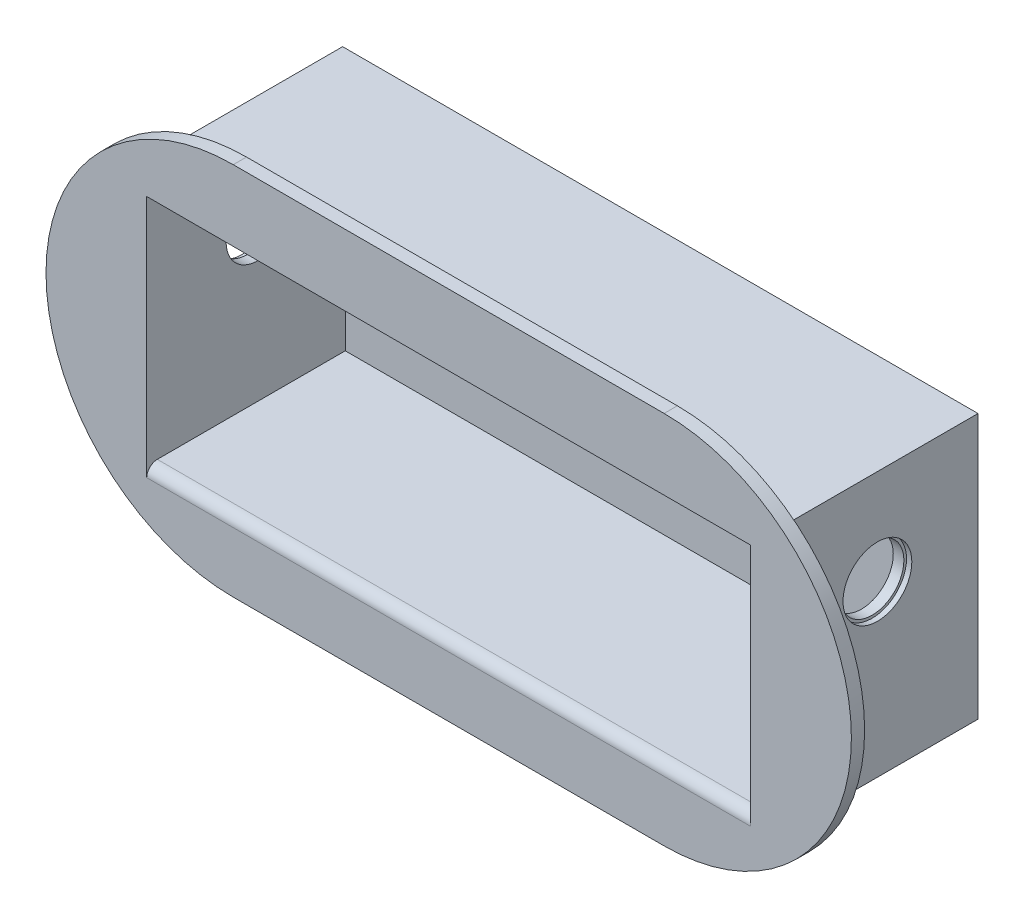
from build123d import *

# Parameters (mm, degrees)
SKETCH1_W           = 304.8
SKETCH1_H           = 127
BOSS_EXTRUDE1_DEPTH = 101.6
CUT_EXTRUDE2_DEPTH  = 95.25
SKETCH3_W           = 289.56
SKETCH3_H           = 111.76
BOSS_EXTRUDE2_DEPTH = 6.35
SKETCH5_R           = 15.24
CUT_EXTRUDE4_DEPTH  = 372.316040041
FILLET2_R           = 5.08
SKETCH6_R           = 16.51
CUT_EXTRUDE5_DEPTH  = 2.54


with BuildPart() as part:
    # Sketch1 → Boss-Extrude1 (new body)
    with BuildSketch(Plane.XY):
        Rectangle(SKETCH1_W, SKETCH1_H)
    extrude(amount=BOSS_EXTRUDE1_DEPTH)

    # 3DSketch1 → Cut-Extrude2 (cut)
    with BuildSketch(Plane(origin=(144.78, 55.88, 101.6), x_dir=(-0.9329231300425795, -0.36007559405152184, 0), z_dir=(0, 0, 1))):
        Polygon((0, 0), (270.137221535, -104.263489014), (310.379269926, 0), (40.242048391, 104.263489014), align=None)
    extrude(amount=-CUT_EXTRUDE2_DEPTH, mode=Mode.SUBTRACT)

    # Sketch3 → Boss-Extrude2 (add)
    with BuildSketch(Plane.XY.offset(101.6)):
        with BuildLine():
            Line((-103.259510137, 89.837120171), (103.425046446, 89.837120171))
            ThreePointArc((103.425046446, 89.837120171), (193.262166618, 0), (103.425046446, -89.837120171))
            Line((103.425046446, -89.837120171), (-103.259510137, -89.837120171))
            ThreePointArc((-103.259510137, -89.837120171), (-193.096630308, 0), (-103.259510137, 89.837120171))
        make_face()
        Rectangle(SKETCH3_W, SKETCH3_H, mode=Mode.SUBTRACT)
    extrude(amount=-BOSS_EXTRUDE2_DEPTH)

    # Sketch5 → Cut-Extrude4 (cut, through all)
    with BuildSketch(Plane.ZY.offset(152.4)):
        with Locations(Location((48.26, 17.78, 0), (0, 0, 270))):
            Circle(SKETCH5_R)
    extrude(amount=-CUT_EXTRUDE4_DEPTH, mode=Mode.SUBTRACT)

    # Fillet2
    fillet2_edges = [part.edges().sort_by_distance(p)[0] for p in [
        (0, -55.88, 101.6),
    ]]
    fillet(fillet2_edges, radius=FILLET2_R)

    # Sketch6 → Cut-Extrude5 (cut)
    with BuildSketch(Plane(origin=(152.4, 0, 0), x_dir=(0, 0, -1), z_dir=(1, 0, 0))):
        with Locations((-48.26, 17.78)):
            Circle(SKETCH6_R)
    cut_extrude5 = extrude(amount=-CUT_EXTRUDE5_DEPTH, mode=Mode.SUBTRACT)

    # Mirror1: Cut-Extrude5 across plane
    add(cut_extrude5.mirror(Plane(origin=(0, 0, 0), x_dir=(0, 0, 1), z_dir=(1, 0, 0))), mode=Mode.SUBTRACT)


solid = part.part
